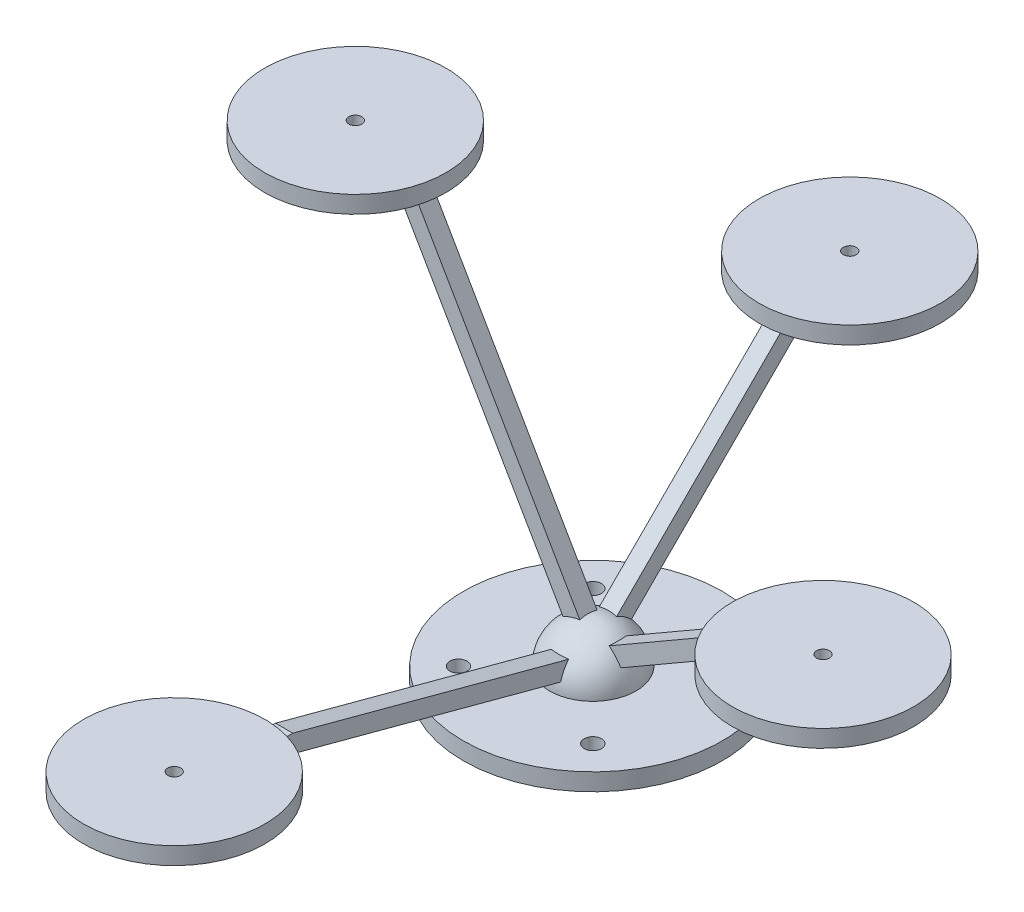
from build123d import *

# Parameters (mm, degrees)
SKETCH_1_R      = 15
SKETCH_1_R_2    = 1
EXTRUDE_1_DEPTH = 2
EXTRUDE_2_DEPTH = 1
SKETCH_4_R      = 10.5
SKETCH_4_R_2    = 0.75
EXTRUDE_3_DEPTH = 2
SKETCH_5_R      = 10.5
SKETCH_5_R_2    = 0.75
EXTRUDE_4_DEPTH = 2
EXTRUDE_5_DEPTH = 1
SKETCH_7_R      = 10.5
SKETCH_7_R_2    = 0.75
EXTRUDE_6_DEPTH = 2
SKETCH_8_R      = 10.5
SKETCH_8_R_2    = 0.75
EXTRUDE_7_DEPTH = 2


with BuildPart() as part:
    # 草图1 → 凸台-拉伸1 (new body)
    with BuildSketch(Plane(origin=(0, 0, 0), x_dir=(1, 0, 0), z_dir=(0, 1, 0))):
        with Locations(Location((0, 0, 0), (0, 0, 270))):
            Circle(SKETCH_1_R)
        with Locations(Location((7.778174593, 7.778174593, 0), (0, 0, 270))):
            Circle(SKETCH_1_R_2, mode=Mode.SUBTRACT)
        with Locations(Location((-7.778174593, 7.778174593, 0), (0, 0, 270))):
            Circle(SKETCH_1_R_2, mode=Mode.SUBTRACT)
        with Locations(Location((-7.778174593, -7.778174593, 0), (0, 0, 270))):
            Circle(SKETCH_1_R_2, mode=Mode.SUBTRACT)
        with Locations(Location((7.778174593, -7.778174593, 0), (0, 0, 270))):
            Circle(SKETCH_1_R_2, mode=Mode.SUBTRACT)
    extrude(amount=EXTRUDE_1_DEPTH)

    # 草图2 → 旋转1 (revolve)
    with BuildSketch(Plane(origin=(0, 0, 0), x_dir=(0, 0, -1), z_dir=(1, 0, 0))):
        with BuildLine():
            Line((0, 2), (0, 7))
            ThreePointArc((0, 7), (3.535533906, 5.535533906), (5, 2))
            Line((5, 2), (0, 2))
        make_face()
    revolve(axis=Axis((0, 2, 0), (0, 1, 0)))

    # 草图3 → 凸台-拉伸2 (add, symmetric)
    with BuildSketch(Plane.XY):
        Polygon((0, 2), (21.650635095, 14.5), (17.650635095, 14.5), (0, 4.309401077), (0, 6), (-20.190598923, 40.97114317), (-22.5, 40.97114317), align=None)
    extrude(amount=EXTRUDE_2_DEPTH, both=True)

    # 草图4 → 凸台-拉伸3 (add)
    with BuildSketch(Plane(origin=(0, 14.5, 0), x_dir=(1, 0, 0), z_dir=(0, 1, 0))):
        with Locations(Location((26.650635095, 0, 0), (0, 0, 270))):
            Circle(SKETCH_4_R)
        with Locations(Location((26.650635095, 0, 0), (0, 0, 270))):
            Circle(SKETCH_4_R_2, mode=Mode.SUBTRACT)
    extrude(amount=EXTRUDE_3_DEPTH)

    # 草图5 → 凸台-拉伸4 (add)
    with BuildSketch(Plane(origin=(0, 40.97114317, 0), x_dir=(1, 0, 0), z_dir=(0, 1, 0))):
        with Locations(Location((-27.5, 0, 0), (0, 0, 270))):
            Circle(SKETCH_5_R)
        with Locations(Location((-27.5, 0, 0), (0, 0, 270))):
            Circle(SKETCH_5_R_2, mode=Mode.SUBTRACT)
    extrude(amount=EXTRUDE_4_DEPTH)

    # 草图6 → 凸台-拉伸5 (add, symmetric)
    with BuildSketch(Plane(origin=(0, 0, 0), x_dir=(0, 0, -1), z_dir=(1, 0, 0))):
        Polygon((0, 2), (24.748737342, 26.748737342), (21.920310217, 26.748737342), (0, 4.828427125), (0, 4.070552361), (-35.739255573, 13.64685703), (-43.466662183, 13.64685703), align=None)
    extrude(amount=EXTRUDE_5_DEPTH, both=True)

    # 草图7 → 凸台-拉伸6 (add)
    with BuildSketch(Plane(origin=(0, 26.748737342, 0), x_dir=(1, 0, 0), z_dir=(0, 1, 0))):
        with Locations(Location((0, 29.748737342, 0), (0, 0, 270))):
            Circle(SKETCH_7_R)
        with Locations(Location((0, 29.748737342, 0), (0, 0, 270))):
            Circle(SKETCH_7_R_2, mode=Mode.SUBTRACT)
    extrude(amount=EXTRUDE_6_DEPTH)

    # 草图8 → 凸台-拉伸7 (add)
    with BuildSketch(Plane(origin=(0, 13.64685703, 0), x_dir=(1, 0, 0), z_dir=(0, 1, 0))):
        with Locations(Location((0, -48.466662183, 0), (0, 0, 95.4650238))):
            Circle(SKETCH_8_R)
        with Locations(Location((0, -48.466662183, 0), (0, 0, 270))):
            Circle(SKETCH_8_R_2, mode=Mode.SUBTRACT)
    extrude(amount=EXTRUDE_7_DEPTH)


solid = part.part
